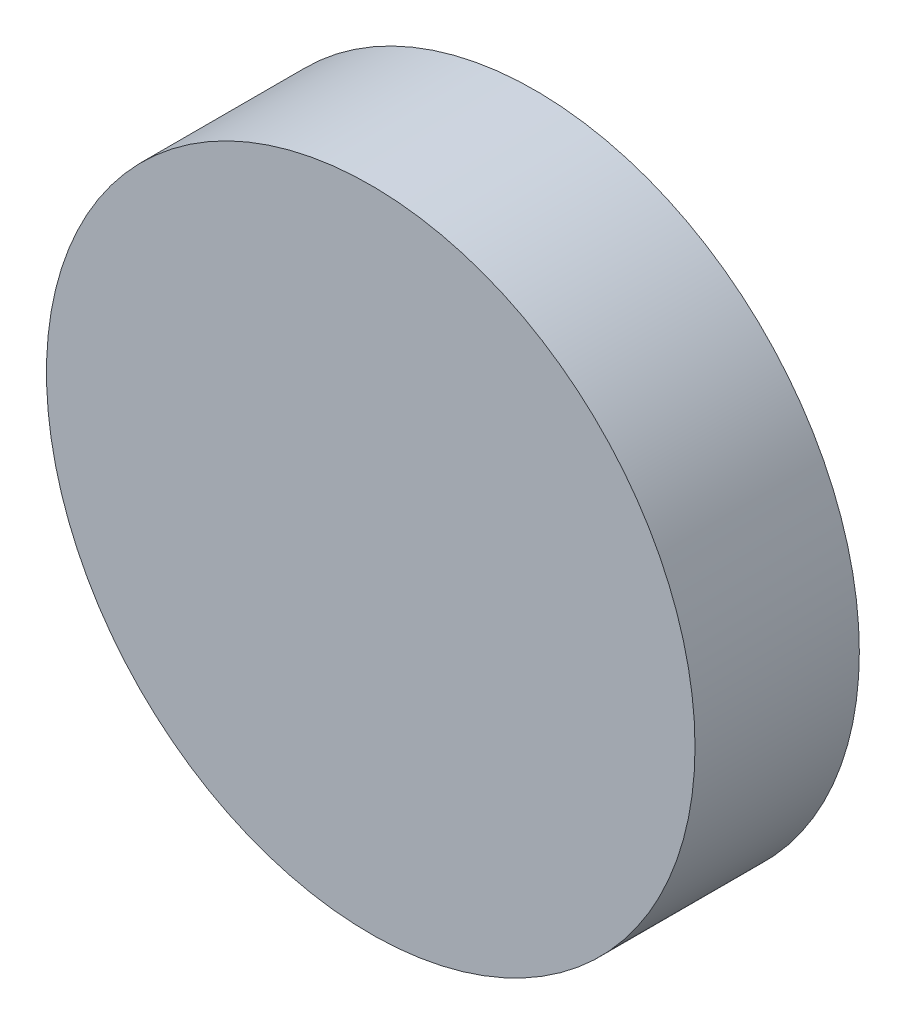
from build123d import *

# Parameters (mm, degrees)
SKETCH1_R           = 19.733214879
BOSS_EXTRUDE1_DEPTH = 10


with BuildPart() as part:
    # Sketch1 → Boss-Extrude1 (new body)
    with BuildSketch(Plane.XY):
        with Locations((-47.034771548, 0)):
            Circle(SKETCH1_R)
    extrude(amount=BOSS_EXTRUDE1_DEPTH)


solid = part.part
